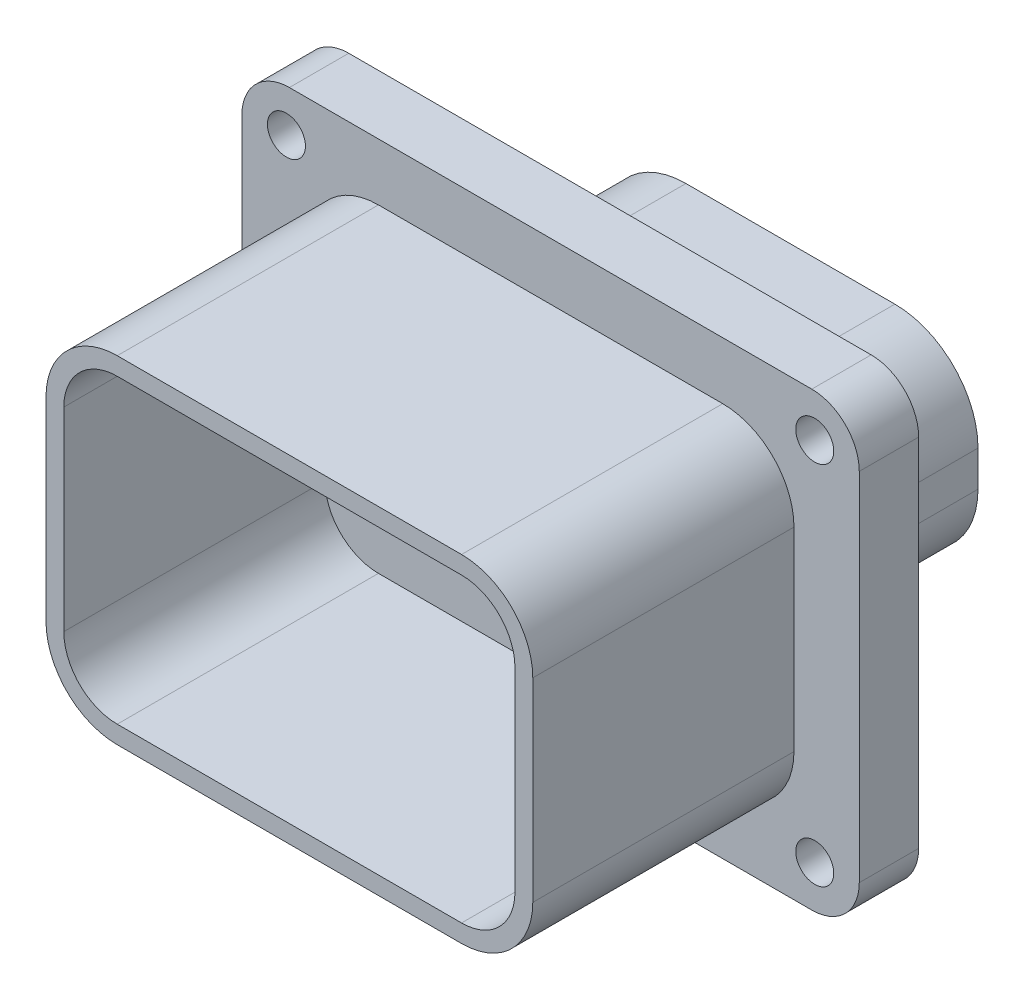
from build123d import *

# Parameters (mm, degrees)
SKETCH1_W           = 52
SKETCH1_H           = 38
SKETCH1_R           = 1.6
BOSS_EXTRUDE1_DEPTH = 5
SKETCH5_W           = 31.6
SKETCH5_H           = 17
BOSS_EXTRUDE2_DEPTH = 15.2
BOSS_EXTRUDE3_DEPTH = 22
FILLET1_R           = 4
FILLET2_R           = 7


with BuildPart() as part:
    # Sketch1 → Boss-Extrude1 (new body)
    with BuildSketch(Plane.XY):
        with Locations((26, 19)):
            Rectangle(SKETCH1_W, SKETCH1_H)
        with Locations((3.75, 34.4)):
            Circle(SKETCH1_R, mode=Mode.SUBTRACT)
        with Locations((48.25, 34.4)):
            Circle(SKETCH1_R, mode=Mode.SUBTRACT)
        with Locations((48.25, 3.6)):
            Circle(SKETCH1_R, mode=Mode.SUBTRACT)
        with Locations((3.75, 3.6)):
            Circle(SKETCH1_R, mode=Mode.SUBTRACT)
    extrude(amount=BOSS_EXTRUDE1_DEPTH)

    # Sketch5 → Boss-Extrude2 (add)
    with BuildSketch(Plane(origin=(0, 0, 0), x_dir=(-1, 0, 0), z_dir=(0, 0, -1))):
        with Locations((-26, 19)):
            Rectangle(SKETCH5_W, SKETCH5_H)
    extrude(amount=BOSS_EXTRUDE2_DEPTH)

    # Sketch7 → Boss-Extrude3 (add)
    with BuildSketch(Plane.XY.offset(5)):
        with BuildLine():
            Line((11.5, 33.188764045), (40.5, 33.188764045))
            ThreePointArc((40.5, 33.188764045), (44.742640687, 31.431404732), (46.5, 27.188764045))
            Line((46.5, 27.188764045), (46.5, 10.811235955))
            ThreePointArc((46.5, 10.811235955), (44.742640687, 6.568595268), (40.5, 4.811235955))
            Line((40.5, 4.811235955), (11.5, 4.811235955))
            ThreePointArc((11.5, 4.811235955), (7.257359313, 6.568595268), (5.5, 10.811235955))
            Line((5.5, 10.811235955), (5.5, 27.188764045))
            ThreePointArc((5.5, 27.188764045), (7.257359313, 31.431404732), (11.5, 33.188764045))
        make_face()
        with BuildLine():
            Line((11.5, 31.688764045), (40.5, 31.688764045))
            ThreePointArc((40.5, 31.688764045), (43.681980515, 30.37074456), (45, 27.188764045))
            Line((45, 27.188764045), (45, 10.811235955))
            ThreePointArc((45, 10.811235955), (43.681980515, 7.62925544), (40.5, 6.311235955))
            Line((40.5, 6.311235955), (11.5, 6.311235955))
            ThreePointArc((11.5, 6.311235955), (8.318019485, 7.62925544), (7, 10.811235955))
            Line((7, 10.811235955), (7, 27.188764045))
            ThreePointArc((7, 27.188764045), (8.318019485, 30.37074456), (11.5, 31.688764045))
        make_face(mode=Mode.SUBTRACT)
    extrude(amount=BOSS_EXTRUDE3_DEPTH)

    # Fillet1
    fillet1_edges = [part.edges().sort_by_distance(p)[0] for p in [
        (0, 0, 2.5),
        (0, 38, 2.5),
        (52, 38, 2.5),
        (52, 0, 2.5),
    ]]
    fillet(fillet1_edges, radius=FILLET1_R)

    # Fillet2
    fillet2_edges = [part.edges().sort_by_distance(p)[0] for p in [
        (41.8, 27.5, -7.6),
        (41.8, 10.5, -7.6),
        (10.2, 10.5, -7.6),
        (10.2, 27.5, -7.6),
    ]]
    fillet(fillet2_edges, radius=FILLET2_R)


solid = part.part
